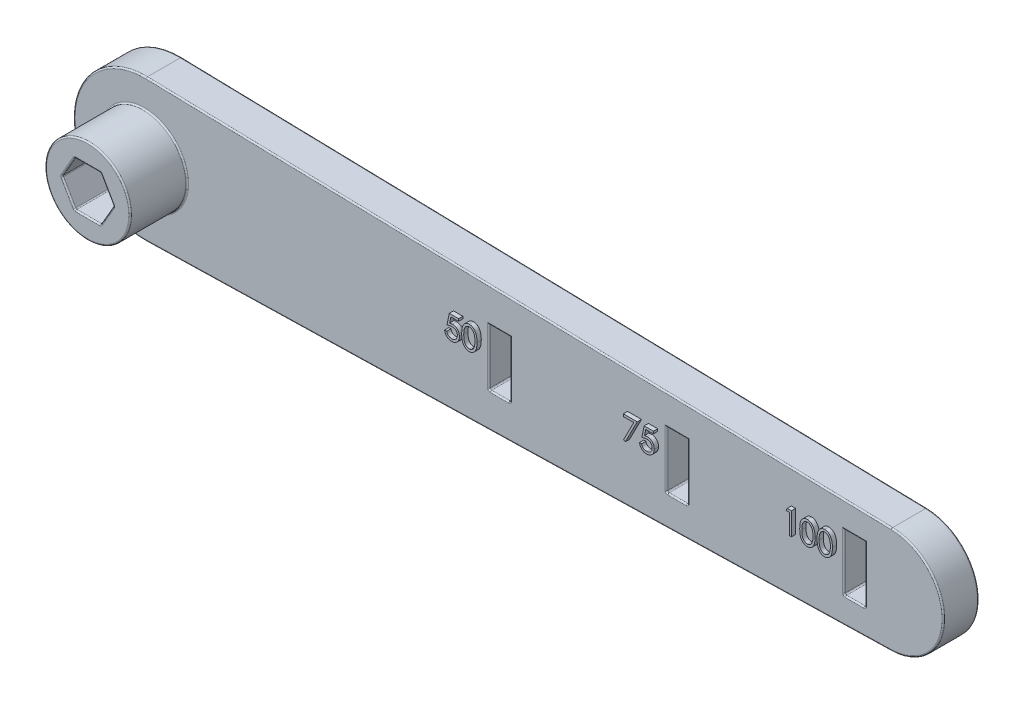
from build123d import *

# Parameters (mm, degrees)
BOSS_EXTRUDE1_DEPTH = 5
CUT_EXTRUDE2_REACH  = 115.054
CUT_EXTRUDE3_REACH  = 115.054
SKETCH4_W           = 3
SKETCH4_H           = 8
SKETCH6_R           = 6
BOSS_EXTRUDE3_DEPTH = 8
FILLET1_R           = 0.2
BOSS_EXTRUDE2_DEPTH = 0.6


with BuildPart() as part:
    # Sketch3 → Boss-Extrude1 (new body)
    with BuildSketch(Plane.XY):
        with BuildLine():
            Line((0.238095238, 9.997165131), (105.178571429, 7.497873848))
            ThreePointArc((105.178571429, 7.497873848), (112.5, 0), (105.178571429, -7.497873848))
            Line((105.178571429, -7.497873848), (0.238095238, -9.997165131))
            ThreePointArc((0.238095238, -9.997165131), (-10, 0), (0.238095238, 9.997165131))
        make_face()
    extrude(amount=BOSS_EXTRUDE1_DEPTH)

    # Sketch2 → Cut-Extrude2 (cut, up to next)
    with BuildSketch(Plane.XY, mode=Mode.PRIVATE) as cut_extrude2_sk1:
        Polygon((3.637306696, 0), (1.818653348, 3.15), (-1.818653348, 3.15), (-3.637306696, 0), (-1.818653348, -3.15), (1.818653348, -3.15), align=None)
    cut_extrude2_tool1 = extrude(cut_extrude2_sk1.sketch, amount=CUT_EXTRUDE2_REACH, mode=Mode.PRIVATE) & part.part
    add(cut_extrude2_tool1.solids().sort_by_distance((0, 0, 0))[0], mode=Mode.SUBTRACT)

    # Sketch4 → Cut-Extrude3 (cut, up to next)
    with BuildSketch(Plane.XY.offset(5), mode=Mode.PRIVATE) as cut_extrude3_sk1:
        with Locations((100, 0)):
            Rectangle(SKETCH4_W, SKETCH4_H)
    cut_extrude3_tool1 = extrude(cut_extrude3_sk1.sketch, amount=-CUT_EXTRUDE3_REACH, mode=Mode.PRIVATE) & part.part
    # Sketch4 → Cut-Extrude3 (cut, up to next)
    with BuildSketch(Plane.XY.offset(5), mode=Mode.PRIVATE) as cut_extrude3_sk2:
        with Locations((75, 0)):
            Rectangle(SKETCH4_W, SKETCH4_H)
    cut_extrude3_tool2 = extrude(cut_extrude3_sk2.sketch, amount=-CUT_EXTRUDE3_REACH, mode=Mode.PRIVATE) & part.part
    # Sketch4 → Cut-Extrude3 (cut, up to next)
    with BuildSketch(Plane.XY.offset(5), mode=Mode.PRIVATE) as cut_extrude3_sk3:
        with Locations((50, 0)):
            Rectangle(SKETCH4_W, SKETCH4_H)
    cut_extrude3_tool3 = extrude(cut_extrude3_sk3.sketch, amount=-CUT_EXTRUDE3_REACH, mode=Mode.PRIVATE) & part.part
    add(cut_extrude3_tool1.solids().sort_by_distance((100, 0, 5))[0], mode=Mode.SUBTRACT)
    add(cut_extrude3_tool2.solids().sort_by_distance((75, 0, 5))[0], mode=Mode.SUBTRACT)
    add(cut_extrude3_tool3.solids().sort_by_distance((50, 0, 5))[0], mode=Mode.SUBTRACT)

    # Sketch6 → Boss-Extrude3 (add)
    with BuildSketch(Plane.XY.offset(5)):
        Circle(SKETCH6_R)
        Polygon((3.637306696, 0), (1.818653348, 3.15), (-1.818653348, 3.15), (-3.637306696, 0), (-1.818653348, -3.15), (1.818653348, -3.15), align=None, mode=Mode.SUBTRACT)
    extrude(amount=BOSS_EXTRUDE3_DEPTH)

    # Fillet1
    fillet1_edges = [part.edges().sort_by_distance(p)[0] for p in [
        (112.5, 0, 5),
        (52.708333333, 8.74751949, 5),
        (1.818653348, -3.15, 6.5),
        (2.727980022, -1.575, 0),
        (3.637306696, 0, 6.5),
        (2.727980022, 1.575, 0),
        (1.818653348, 3.15, 6.5),
        (0, 3.15, 0),
        (-1.818653348, 3.15, 6.5),
        (-2.727980022, 1.575, 0),
        (-3.637306696, 0, 6.5),
        (-2.727980022, -1.575, 0),
        (-1.818653348, -3.15, 6.5),
        (0, -3.15, 0),
        (98.5, -4, 2.5),
        (101.5, -4, 2.5),
        (98.5, 0, 5),
        (100, -4, 5),
        (101.5, 0, 5),
        (100, 4, 5),
        (100, -4, 0),
        (98.5, 0, 0),
        (100, 4, 0),
        (101.5, 0, 0),
        (-10, 0, 5),
        (52.708333333, 8.74751949, 0),
        (73.5, -4, 2.5),
        (76.5, -4, 2.5),
        (73.5, 0, 5),
        (75, -4, 5),
        (76.5, 0, 5),
        (75, 4, 5),
        (75, -4, 0),
        (73.5, 0, 0),
        (75, 4, 0),
        (76.5, 0, 0),
        (112.5, 0, 0),
        (48.5, -4, 2.5),
        (51.5, -4, 2.5),
        (48.5, 0, 5),
        (50, -4, 5),
        (52.708333333, -8.74751949, 0),
        (51.5, 0, 5),
        (50, 4, 5),
        (50, -4, 0),
        (48.5, 0, 0),
        (50, 4, 0),
        (51.5, 0, 0),
        (-10, 0, 0),
        (-6, 0, 13),
        (-6, 0, 5),
        (2.727980022, -1.575, 13),
        (2.727980022, 1.575, 13),
        (0, 3.15, 13),
        (-2.727980022, 1.575, 13),
        (-2.727980022, -1.575, 13),
        (0, -3.15, 13),
        (52.708333333, -8.74751949, 5),
    ]]
    fillet(fillet1_edges, radius=FILLET1_R)

    # Sketch5 → Boss-Extrude2 (add)
    # profile 1 of 7: a face of its own
    with BuildSketch(Plane.XY.offset(5)):
        with BuildLine():
            Line((44.816666667, 3.175), (44.816666667, 2.849358974))
            Line((44.816666667, 2.849358974), (43.736708734, 2.849358974))
            Line((43.736708734, 2.849358974), (43.565619992, 2.014267829))
            add(Edge.make_bspline(
                [(43.565619992, 2.014267829), (43.599234964, 2.023548147), (43.664358655, 2.041527295), (43.760479386, 2.061489672), (43.851730885, 2.073523325), (43.910944971, 2.075166443), (43.939598357, 2.075961538)],
                knots=[0, 0, 0, 0, 1.100273476, 2.13160584, 3.095893838, 4, 4, 4, 4], degree=3))
            add(Edge.make_bspline(
                [(43.939598357, 2.075961538), (43.975052893, 2.075194154), (44.044765367, 2.073685284), (44.146763555, 2.059196535), (44.244129822, 2.036391041), (44.336660544, 2.004531711), (44.424526901, 1.963792167), (44.506920474, 1.912901507), (44.58507801, 1.853453414), (44.657597363, 1.785104724), (44.723387271, 1.709882972), (44.781232133, 1.629004046), (44.83036534, 1.543253952), (44.869881167, 1.4518134), (44.901435528, 1.355693311), (44.922437695, 1.253882325), (44.936422852, 1.147340102), (44.937985302, 1.074492385), (44.938782051, 1.037344752)],
                knots=[0, 0, 0, 0, 1.052922333, 2.070308379, 3.05430497, 4.020497103, 4.973039431, 5.925935799, 6.892292201, 7.88610001, 8.88166317, 9.857072816, 10.836096531, 11.812156883, 12.81219415, 13.836441305, 14.89672472, 16, 16, 16, 16], degree=3))
            add(Edge.make_bspline(
                [(44.938782051, 1.037344752), (44.938178733, 1.011471023), (44.93698025, 0.960073227), (44.930885531, 0.883742417), (44.919150989, 0.809027561), (44.903395982, 0.735918748), (44.882946788, 0.664554389), (44.858191718, 0.594730218), (44.82789675, 0.526880824), (44.79466686, 0.460364216), (44.757250412, 0.396684142), (44.715722766, 0.337131132), (44.671848356, 0.28081182), (44.624639385, 0.228330219), (44.573657054, 0.180031196), (44.519518798, 0.135628112), (44.462656617, 0.094370048), (44.40219079, 0.057931757), (44.339468681, 0.024401075), (44.273584512, -0.003106705), (44.20603802, -0.027699827), (44.135857025, -0.047302756), (44.063200495, -0.062663002), (43.987948663, -0.073095689), (43.910496198, -0.080694315), (43.857995294, -0.081169982), (43.831475361, -0.081410256)],
                knots=[0, 0, 0, 0, 1.056347294, 2.098418968, 3.122841568, 4.141288669, 5.149314143, 6.15115421, 7.162517403, 8.180376062, 9.185164535, 10.17417709, 11.141909838, 12.097768115, 13.052685741, 14.0056014, 14.954263652, 15.917497458, 16.885230207, 17.854509472, 18.828990115, 19.81800267, 20.826176721, 21.857883937, 22.917946725, 24, 24, 24, 24], degree=3))
            add(Edge.make_bspline(
                [(43.831475361, -0.081410256), (43.799839497, -0.080783568), (43.737599672, -0.079550632), (43.646413157, -0.066652434), (43.558679194, -0.048179453), (43.47510403, -0.02038798), (43.39493867, 0.014434781), (43.319262347, 0.058445879), (43.246141393, 0.10831978), (43.178548331, 0.167175529), (43.115813857, 0.231506183), (43.05965581, 0.301317758), (43.009641779, 0.375458038), (42.96657268, 0.454287077), (42.929835189, 0.537597745), (42.90097445, 0.625702181), (42.877680514, 0.718140042), (42.867825839, 0.781779298), (42.862820513, 0.814102564)],
                knots=[0, 0, 0, 0, 1.0467383, 2.05933395, 3.04377827, 4.011590433, 4.970194871, 5.932262533, 6.905835911, 7.896367577, 8.894135286, 9.877477877, 10.858688626, 11.851381753, 12.8477658, 13.868841284, 14.917554742, 16, 16, 16, 16], degree=3))
            Line((42.862820513, 0.814102564), (43.14775641, 0.814102564))
            add(Edge.make_bspline(
                [(43.14775641, 0.814102564), (43.154767316, 0.783825354), (43.168242666, 0.725630874), (43.197820738, 0.643868872), (43.233984782, 0.571007861), (43.276987298, 0.506084025), (43.328286254, 0.449470149), (43.386823665, 0.399017529), (43.452453385, 0.353501518), (43.525381529, 0.315562294), (43.602319108, 0.283205639), (43.682843649, 0.261659459), (43.764762592, 0.246509363), (43.820169399, 0.244992837), (43.848011819, 0.244230769)],
                knots=[0, 0, 0, 0, 1.136247022, 2.183929868, 3.172523383, 4.106158343, 5.02341133, 5.958108904, 6.928429099, 7.938127109, 8.96079061, 9.975095812, 10.982467395, 12, 12, 12, 12], degree=3))
            add(Edge.make_bspline(
                [(43.848011819, 0.244230769), (43.875188408, 0.244975332), (43.928699334, 0.246441382), (44.007449663, 0.257725343), (44.083479913, 0.275103997), (44.156039872, 0.301111651), (44.226399269, 0.332720789), (44.292778332, 0.37328375), (44.357097371, 0.419965339), (44.417357178, 0.473447424), (44.472547249, 0.532384219), (44.521311731, 0.59541014), (44.561930788, 0.662644708), (44.596161015, 0.732923925), (44.622153651, 0.807018045), (44.640696541, 0.884579825), (44.65158503, 0.965800843), (44.653082886, 1.021199431), (44.653846154, 1.049429087)],
                knots=[0, 0, 0, 0, 1.027316725, 2.022795036, 3.002884548, 3.971462791, 4.93288096, 5.914575861, 6.907176829, 7.935150275, 8.956128384, 9.956726525, 10.942570165, 11.921478529, 12.907843606, 13.90538589, 14.932640048, 16, 16, 16, 16], degree=3))
            add(Edge.make_bspline(
                [(44.653846154, 1.049429087), (44.653248819, 1.074897804), (44.652079621, 1.124749195), (44.642526889, 1.197682761), (44.625910778, 1.266691878), (44.602847687, 1.33210979), (44.573565563, 1.393998198), (44.537782122, 1.452420974), (44.494825825, 1.506608094), (44.445756755, 1.556584911), (44.392001246, 1.602708476), (44.332634423, 1.642027754), (44.268898632, 1.675105737), (44.201561781, 1.703651707), (44.129022195, 1.724153812), (44.052716392, 1.739546108), (43.971820379, 1.748450044), (43.916511254, 1.749685471), (43.888080929, 1.750320513)],
                knots=[0, 0, 0, 0, 1.045622112, 2.046656509, 3.013763289, 3.955457236, 4.890082067, 5.820317437, 6.762574623, 7.722996705, 8.69280354, 9.665887285, 10.63943826, 11.638615906, 12.663482002, 13.728887084, 14.832589034, 16, 16, 16, 16], degree=3))
            add(Edge.make_bspline(
                [(43.888080929, 1.750320513), (43.863471115, 1.749793834), (43.812658093, 1.748706375), (43.734713815, 1.740699481), (43.652806323, 1.727782407), (43.567249602, 1.710014883), (43.477786713, 1.686763834), (43.384606449, 1.658901395), (43.287512893, 1.625589296), (43.222091814, 1.600432216), (43.188461538, 1.5875)],
                knots=[0, 0, 0, 0, 0.817624296, 1.688186739, 2.600797293, 3.572016777, 4.590301741, 5.671205678, 6.80286297, 8, 8, 8, 8], degree=3))
            Line((43.188461538, 1.5875), (43.514102564, 3.175))
            Line((43.514102564, 3.175), (44.816666667, 3.175))
        make_face()
    # profile 2 of 7: a face of its own
    with BuildSketch(Plane.XY.offset(5)):
        with BuildLine():
            add(Edge.make_bspline(
                [(45.264423077, 1.586227965), (45.264720636, 1.637116309), (45.26529865, 1.735967652), (45.27172886, 1.880008006), (45.282410778, 2.015136268), (45.29704968, 2.141358907), (45.314864134, 2.258708507), (45.338645325, 2.366871466), (45.365689796, 2.466348394), (45.3970338, 2.557463681), (45.432401295, 2.641444883), (45.470895231, 2.719844887), (45.514043295, 2.792545069), (45.559379494, 2.860705779), (45.608739016, 2.923211273), (45.660717205, 2.98094426), (45.717342764, 3.032570441), (45.776690779, 3.079602444), (45.839298571, 3.120831607), (45.903381561, 3.15714702), (45.969380836, 3.188171185), (46.037476588, 3.212564652), (46.107056765, 3.232713063), (46.178364604, 3.246491609), (46.251517842, 3.25516109), (46.300894929, 3.255989917), (46.325936498, 3.256410256)],
                knots=[0, 0, 0, 0, 1.646270934, 3.197905019, 4.663502075, 6.030701355, 7.308322542, 8.50163776, 9.611534131, 10.641858119, 11.616356847, 12.558055219, 13.465016945, 14.349605745, 15.204443733, 16.039544428, 16.859896111, 17.680448484, 18.487036065, 19.28249412, 20.06191084, 20.843045899, 21.620316918, 22.403196591, 23.190181807, 24, 24, 24, 24], degree=3))
            add(Edge.make_bspline(
                [(46.325936498, 3.256410256), (46.351187254, 3.255967738), (46.401403062, 3.255087709), (46.475643974, 3.246629561), (46.548169756, 3.232595043), (46.618671211, 3.212709587), (46.687727449, 3.188039223), (46.754798333, 3.157117338), (46.820300471, 3.121122937), (46.883192946, 3.07882842), (46.944166204, 3.031673069), (47.001722571, 2.978366934), (47.055867284, 2.91944826), (47.107279883, 2.855547427), (47.154501746, 2.785438814), (47.199471931, 2.7103418), (47.239723706, 2.628943087), (47.278490162, 2.542600805), (47.311951928, 2.448925915), (47.342129165, 2.348446454), (47.366512229, 2.239975584), (47.386822498, 2.124082419), (47.402556796, 2.000341345), (47.414016407, 1.869017616), (47.420069849, 1.730024833), (47.421209856, 1.634994498), (47.421794872, 1.586227965)],
                knots=[0, 0, 0, 0, 0.810914788, 1.612654377, 2.396697861, 3.181598691, 3.963628158, 4.749916497, 5.551656086, 6.361998678, 7.18212741, 8.025565596, 8.878627764, 9.750805457, 10.657531673, 11.591944965, 12.560506719, 13.57287815, 14.630710178, 15.753379473, 16.941251878, 18.199788006, 19.531962791, 20.947069417, 22.433333509, 24, 24, 24, 24], degree=3))
            add(Edge.make_bspline(
                [(47.421794872, 1.586227965), (47.421203792, 1.537674134), (47.420052096, 1.443068975), (47.414084269, 1.30470159), (47.402328939, 1.174074794), (47.387624164, 1.050875303), (47.367257933, 0.935615891), (47.342216104, 0.827897713), (47.314411883, 0.727255591), (47.280090319, 0.634514012), (47.242524889, 0.548379235), (47.20165339, 0.467945464), (47.157865762, 0.392501756), (47.110160258, 0.322651986), (47.059311804, 0.257901347), (47.004232096, 0.199392789), (46.946473779, 0.145716537), (46.885321088, 0.097953989), (46.821447752, 0.056148487), (46.756170589, 0.018761637), (46.688331377, -0.011385165), (46.619467484, -0.037270523), (46.548593895, -0.057046647), (46.475798955, -0.070720788), (46.401452941, -0.080310965), (46.351195807, -0.081042557), (46.325936498, -0.081410256)],
                knots=[0, 0, 0, 0, 1.561518951, 3.042555995, 4.452378317, 5.7783523, 7.031515105, 8.214008947, 9.334062868, 10.386615937, 11.391082383, 12.354592575, 13.286541444, 14.194233754, 15.072674879, 15.931287219, 16.775624067, 17.606195743, 18.42308326, 19.229000347, 20.022332153, 20.807536673, 21.593273796, 22.3848459, 23.188221202, 24, 24, 24, 24], degree=3))
            add(Edge.make_bspline(
                [(46.325936498, -0.081410256), (46.300895624, -0.080987205), (46.251519906, -0.080153031), (46.178356634, -0.071522718), (46.107343275, -0.057647511), (46.038129405, -0.038219592), (45.970359924, -0.01443899), (45.904958292, 0.01654328), (45.841197322, 0.052224899), (45.779247125, 0.092860746), (45.720271807, 0.139416844), (45.663939501, 0.190910163), (45.611665377, 0.248625686), (45.56301159, 0.311652088), (45.51677081, 0.379409529), (45.47423545, 0.452823125), (45.434891889, 0.531601779), (45.39892958, 0.616254455), (45.367044721, 0.708016425), (45.338880014, 0.807937466), (45.316642171, 0.916899507), (45.297607633, 1.034027404), (45.2822548, 1.15982447), (45.271773376, 1.294358997), (45.265295184, 1.437547151), (45.264719084, 1.535763303), (45.264423077, 1.586227965)],
                knots=[0, 0, 0, 0, 0.810891512, 1.598919785, 2.382837074, 3.152667961, 3.926044502, 4.706494248, 5.493654104, 6.291793342, 7.103789334, 7.925228297, 8.761435821, 9.622817696, 10.50288917, 11.416980706, 12.369136599, 13.353924996, 14.394355917, 15.514179734, 16.714354668, 17.994756427, 19.357759367, 20.818452758, 22.365282078, 24, 24, 24, 24], degree=3))
        make_face()
        with BuildLine():
            add(Edge.make_bspline(
                [(45.549358974, 1.5875), (45.54946733, 1.545092252), (45.549677627, 1.46278714), (45.555171466, 1.343186467), (45.562655605, 1.231634812), (45.572308782, 1.127990532), (45.586644313, 1.03260445), (45.6027069, 0.944820523), (45.622254095, 0.865103315), (45.645381719, 0.792905801), (45.671724328, 0.727002717), (45.700486076, 0.665678758), (45.731384017, 0.608209501), (45.765963532, 0.555111156), (45.803623625, 0.506210565), (45.843513653, 0.46064221), (45.887122355, 0.420004948), (45.94745075, 0.371267015), (46.027094694, 0.32090323), (46.12744325, 0.27704642), (46.230556774, 0.249485191), (46.300543979, 0.245980213), (46.335476763, 0.244230769)],
                knots=[0, 0, 0, 0, 1.459021318, 2.831673884, 4.118529203, 5.306027144, 6.411944654, 7.436330062, 8.375795394, 9.233974572, 10.042671642, 10.816086306, 11.563610507, 12.285937304, 12.993564865, 13.685989202, 14.367179055, 15.041617293, 16.353048772, 17.594441528, 18.799311195, 20, 20, 20, 20], degree=3))
            add(Edge.make_bspline(
                [(46.335476763, 0.244230769), (46.370635508, 0.245680185), (46.440880408, 0.248576023), (46.543508922, 0.276514878), (46.643140667, 0.318669388), (46.721220213, 0.368514626), (46.780622235, 0.415983896), (46.823182647, 0.456455755), (46.862246077, 0.501772864), (46.899295673, 0.550667225), (46.933276406, 0.604072978), (46.964176538, 0.661733315), (46.992373575, 0.723808354), (47.00843821, 0.767142332), (47.016651643, 0.789297877)],
                knots=[0, 0, 0, 0, 1.353760809, 2.704726607, 4.075137775, 5.516104923, 6.260822281, 7.007110065, 7.778089737, 8.566572457, 9.372053459, 10.217411131, 11.088608312, 12, 12, 12, 12], degree=3))
            add(Edge.make_bspline(
                [(47.016651643, 0.789297877), (47.026223603, 0.817627712), (47.045658789, 0.875149426), (47.070706613, 0.964379311), (47.090432796, 1.057998961), (47.108179564, 1.155448888), (47.120292693, 1.25744776), (47.130042495, 1.36367998), (47.135785332, 1.474225644), (47.136497214, 1.549332529), (47.136858974, 1.5875)],
                knots=[0, 0, 0, 0, 0.884706709, 1.796334032, 2.740027952, 3.714592787, 4.726048262, 5.777819803, 6.87074269, 8, 8, 8, 8], degree=3))
            add(Edge.make_bspline(
                [(47.136858974, 1.5875), (47.136359874, 1.625661298), (47.135383527, 1.700312955), (47.131651553, 1.809640161), (47.122014453, 1.913478773), (47.111310967, 2.01227613), (47.095529202, 2.105485333), (47.078513191, 2.193886682), (47.055652092, 2.276384997), (47.03123201, 2.354271903), (47.00328258, 2.426662497), (46.972516164, 2.493894289), (46.939657854, 2.556291861), (46.903968822, 2.613684015), (46.865872738, 2.666327822), (46.824364104, 2.713167775), (46.781089423, 2.755655596), (46.72047669, 2.804153784), (46.641125013, 2.853603679), (46.542386461, 2.89911119), (46.439633805, 2.925244427), (46.370170743, 2.928928957), (46.335476763, 2.930769231)],
                knots=[0, 0, 0, 0, 1.31362396, 2.569729283, 3.763502607, 4.902122613, 5.988968491, 7.01645872, 7.998833611, 8.933434873, 9.825090667, 10.667526885, 11.477055099, 12.250526234, 12.991942729, 13.710640831, 14.402115721, 15.076753259, 16.378508321, 17.609869233, 18.806226677, 20, 20, 20, 20], degree=3))
            add(Edge.make_bspline(
                [(46.335476763, 2.930769231), (46.300360726, 2.928926418), (46.230064678, 2.925237437), (46.126244034, 2.899208557), (46.026726515, 2.853839652), (45.947584674, 2.80399), (45.886929667, 2.756511674), (45.844218938, 2.715339677), (45.804172053, 2.670303432), (45.76728064, 2.620953123), (45.732728219, 2.567916683), (45.700995443, 2.510776875), (45.672404722, 2.449244137), (45.646020893, 2.383370657), (45.622822721, 2.311179371), (45.603687483, 2.231560356), (45.586009942, 2.144055639), (45.573495662, 2.048152943), (45.562370684, 1.944482704), (45.555221175, 1.832652565), (45.549659249, 1.712851306), (45.549461071, 1.630120641), (45.549358974, 1.5875)],
                knots=[0, 0, 0, 0, 1.207732386, 2.417664972, 3.655092373, 4.956220595, 5.625982001, 6.301752483, 6.994047911, 7.697131622, 8.419323945, 9.170223765, 9.943494443, 10.752040957, 11.610060368, 12.549350801, 13.567764191, 14.679664412, 15.874934091, 17.154273443, 18.533957287, 20, 20, 20, 20], degree=3))
        make_face(mode=Mode.SUBTRACT)
    # profile 3 of 7: a face of its own
    with BuildSketch(Plane.XY.offset(5)):
        Polygon((68.025641026, 3.175), (69.979487179, 3.175), (68.310576923, -0.081410256), (68.064438101, 0.054061498), (69.497385817, 2.849358974), (68.025641026, 2.849358974), align=None)
    # profile 4 of 7: a face of its own
    with BuildSketch(Plane.XY.offset(5)):
        with BuildLine():
            Line((72.258974359, 3.175), (72.258974359, 2.849358974))
            Line((72.258974359, 2.849358974), (71.179016426, 2.849358974))
            Line((71.179016426, 2.849358974), (71.007927684, 2.014267829))
            add(Edge.make_bspline(
                [(71.007927684, 2.014267829), (71.041542656, 2.023548147), (71.106666347, 2.041527295), (71.202787078, 2.061489672), (71.294038577, 2.073523325), (71.353252663, 2.075166443), (71.38190605, 2.075961538)],
                knots=[0, 0, 0, 0, 1.100273476, 2.13160584, 3.095893838, 4, 4, 4, 4], degree=3))
            add(Edge.make_bspline(
                [(71.38190605, 2.075961538), (71.417360585, 2.075194154), (71.48707306, 2.073685284), (71.589071247, 2.059196535), (71.686437515, 2.036391041), (71.778968236, 2.004531711), (71.866834593, 1.963792167), (71.949228167, 1.912901507), (72.027385702, 1.853453414), (72.099905055, 1.785104724), (72.165694963, 1.709882972), (72.223539825, 1.629004046), (72.272673032, 1.543253952), (72.31218886, 1.4518134), (72.34374322, 1.355693311), (72.364745387, 1.253882325), (72.378730544, 1.147340102), (72.380292995, 1.074492385), (72.381089744, 1.037344752)],
                knots=[0, 0, 0, 0, 1.052922333, 2.070308379, 3.05430497, 4.020497103, 4.973039431, 5.925935799, 6.892292201, 7.88610001, 8.88166317, 9.857072816, 10.836096531, 11.812156883, 12.81219415, 13.836441305, 14.89672472, 16, 16, 16, 16], degree=3))
            add(Edge.make_bspline(
                [(72.381089744, 1.037344752), (72.380486425, 1.011471023), (72.379287942, 0.960073227), (72.373193223, 0.883742417), (72.361458681, 0.809027561), (72.345703674, 0.735918748), (72.325254481, 0.664554389), (72.30049941, 0.594730218), (72.270204442, 0.526880824), (72.236974552, 0.460364216), (72.199558104, 0.396684142), (72.158030458, 0.337131132), (72.114156048, 0.28081182), (72.066947077, 0.228330219), (72.015964746, 0.180031196), (71.96182649, 0.135628112), (71.904964309, 0.094370048), (71.844498482, 0.057931757), (71.781776373, 0.024401075), (71.715892204, -0.003106705), (71.648345712, -0.027699827), (71.578164718, -0.047302756), (71.505508188, -0.062663002), (71.430256356, -0.073095689), (71.352803891, -0.080694315), (71.300302986, -0.081169982), (71.273783053, -0.081410256)],
                knots=[0, 0, 0, 0, 1.056347294, 2.098418968, 3.122841568, 4.141288669, 5.149314143, 6.15115421, 7.162517403, 8.180376062, 9.185164535, 10.17417709, 11.141909838, 12.097768115, 13.052685741, 14.0056014, 14.954263652, 15.917497458, 16.885230207, 17.854509472, 18.828990115, 19.81800267, 20.826176721, 21.857883937, 22.917946725, 24, 24, 24, 24], degree=3))
            add(Edge.make_bspline(
                [(71.273783053, -0.081410256), (71.242147189, -0.080783568), (71.179907364, -0.079550632), (71.08872085, -0.066652434), (71.000986886, -0.048179453), (70.917411723, -0.02038798), (70.837246362, 0.014434781), (70.761570039, 0.058445879), (70.688449085, 0.10831978), (70.620856024, 0.167175529), (70.558121549, 0.231506183), (70.501963502, 0.301317758), (70.451949471, 0.375458038), (70.408880372, 0.454287077), (70.372142882, 0.537597745), (70.343282142, 0.625702181), (70.319988206, 0.718140042), (70.310133532, 0.781779298), (70.305128205, 0.814102564)],
                knots=[0, 0, 0, 0, 1.0467383, 2.05933395, 3.04377827, 4.011590433, 4.970194871, 5.932262533, 6.905835911, 7.896367577, 8.894135286, 9.877477877, 10.858688626, 11.851381753, 12.8477658, 13.868841284, 14.917554742, 16, 16, 16, 16], degree=3))
            Line((70.305128205, 0.814102564), (70.590064103, 0.814102564))
            add(Edge.make_bspline(
                [(70.590064103, 0.814102564), (70.597075008, 0.783825354), (70.610550358, 0.725630874), (70.64012843, 0.643868872), (70.676292474, 0.571007861), (70.71929499, 0.506084025), (70.770593947, 0.449470149), (70.829131357, 0.399017529), (70.894761078, 0.353501518), (70.967689221, 0.315562294), (71.044626801, 0.283205639), (71.125151341, 0.261659459), (71.207070284, 0.246509363), (71.262477091, 0.244992837), (71.290319511, 0.244230769)],
                knots=[0, 0, 0, 0, 1.136247022, 2.183929868, 3.172523383, 4.106158343, 5.02341133, 5.958108904, 6.928429099, 7.938127109, 8.96079061, 9.975095812, 10.982467395, 12, 12, 12, 12], degree=3))
            add(Edge.make_bspline(
                [(71.290319511, 0.244230769), (71.3174961, 0.244975332), (71.371007026, 0.246441382), (71.449757355, 0.257725343), (71.525787605, 0.275103997), (71.598347565, 0.301111651), (71.668706961, 0.332720789), (71.735086025, 0.37328375), (71.799405063, 0.419965339), (71.85966487, 0.473447424), (71.914854942, 0.532384219), (71.963619423, 0.59541014), (72.00423848, 0.662644708), (72.038468708, 0.732923925), (72.064461343, 0.807018045), (72.083004233, 0.884579825), (72.093892722, 0.965800843), (72.095390578, 1.021199431), (72.096153846, 1.049429087)],
                knots=[0, 0, 0, 0, 1.027316725, 2.022795036, 3.002884548, 3.971462791, 4.93288096, 5.914575861, 6.907176829, 7.935150275, 8.956128384, 9.956726525, 10.942570165, 11.921478529, 12.907843606, 13.90538589, 14.932640048, 16, 16, 16, 16], degree=3))
            add(Edge.make_bspline(
                [(72.096153846, 1.049429087), (72.095556511, 1.074897804), (72.094387313, 1.124749195), (72.084834581, 1.197682761), (72.068218471, 1.266691878), (72.04515538, 1.33210979), (72.015873255, 1.393998198), (71.980089814, 1.452420974), (71.937133518, 1.506608094), (71.888064447, 1.556584911), (71.834308939, 1.602708476), (71.774942115, 1.642027754), (71.711206324, 1.675105737), (71.643869473, 1.703651707), (71.571329887, 1.724153812), (71.495024085, 1.739546108), (71.414128071, 1.748450044), (71.358818947, 1.749685471), (71.330388622, 1.750320513)],
                knots=[0, 0, 0, 0, 1.045622112, 2.046656509, 3.013763289, 3.955457236, 4.890082067, 5.820317437, 6.762574623, 7.722996705, 8.69280354, 9.665887285, 10.63943826, 11.638615906, 12.663482002, 13.728887084, 14.832589034, 16, 16, 16, 16], degree=3))
            add(Edge.make_bspline(
                [(71.330388622, 1.750320513), (71.305778808, 1.749793834), (71.254965785, 1.748706375), (71.177021507, 1.740699481), (71.095114015, 1.727782407), (71.009557294, 1.710014883), (70.920094405, 1.686763834), (70.826914141, 1.658901395), (70.729820585, 1.625589296), (70.664399507, 1.600432216), (70.630769231, 1.5875)],
                knots=[0, 0, 0, 0, 0.817624296, 1.688186739, 2.600797293, 3.572016777, 4.590301741, 5.671205678, 6.80286297, 8, 8, 8, 8], degree=3))
            Line((70.630769231, 1.5875), (70.956410256, 3.175))
            Line((70.956410256, 3.175), (72.258974359, 3.175))
        make_face()
    # profile 5 of 7: a face of its own
    with BuildSketch(Plane.XY.offset(5)):
        Polygon((91.096930088, 3.175), (91.683974359, 3.175), (91.683974359, 0), (91.399038462, 0), (91.399038462, 2.849358974), (90.910576923, 2.849358974), align=None)
    # profile 6 of 7: a face of its own
    with BuildSketch(Plane.XY.offset(5)):
        with BuildLine():
            add(Edge.make_bspline(
                [(92.864423077, 1.586227965), (92.864720636, 1.637116309), (92.86529865, 1.735967652), (92.87172886, 1.880008006), (92.882410778, 2.015136268), (92.89704968, 2.141358907), (92.914864134, 2.258708507), (92.938645325, 2.366871466), (92.965689796, 2.466348394), (92.9970338, 2.557463681), (93.032401295, 2.641444883), (93.070895231, 2.719844887), (93.114043295, 2.792545069), (93.159379494, 2.860705779), (93.208739016, 2.923211273), (93.260717205, 2.98094426), (93.317342764, 3.032570441), (93.376690779, 3.079602444), (93.439298571, 3.120831607), (93.503381561, 3.15714702), (93.569380836, 3.188171185), (93.637476588, 3.212564652), (93.707056765, 3.232713063), (93.778364604, 3.246491609), (93.851517842, 3.25516109), (93.900894929, 3.255989917), (93.925936498, 3.256410256)],
                knots=[0, 0, 0, 0, 1.646270934, 3.197905019, 4.663502075, 6.030701355, 7.308322542, 8.50163776, 9.611534131, 10.641858119, 11.616356847, 12.558055219, 13.465016945, 14.349605745, 15.204443733, 16.039544428, 16.859896111, 17.680448484, 18.487036065, 19.28249412, 20.06191084, 20.843045899, 21.620316918, 22.403196591, 23.190181807, 24, 24, 24, 24], degree=3))
            add(Edge.make_bspline(
                [(93.925936498, 3.256410256), (93.951187254, 3.255967738), (94.001403062, 3.255087709), (94.075643974, 3.246629561), (94.148169756, 3.232595043), (94.218671211, 3.212709587), (94.287727449, 3.188039223), (94.354798333, 3.157117338), (94.420300471, 3.121122937), (94.483192946, 3.07882842), (94.544166204, 3.031673069), (94.601722571, 2.978366934), (94.655867284, 2.91944826), (94.707279883, 2.855547427), (94.754501746, 2.785438814), (94.799471931, 2.7103418), (94.839723706, 2.628943087), (94.878490162, 2.542600805), (94.911951928, 2.448925915), (94.942129165, 2.348446454), (94.966512229, 2.239975584), (94.986822498, 2.124082419), (95.002556796, 2.000341345), (95.014016407, 1.869017616), (95.020069849, 1.730024833), (95.021209856, 1.634994498), (95.021794872, 1.586227965)],
                knots=[0, 0, 0, 0, 0.810914788, 1.612654377, 2.396697861, 3.181598691, 3.963628158, 4.749916497, 5.551656086, 6.361998678, 7.18212741, 8.025565596, 8.878627764, 9.750805457, 10.657531673, 11.591944965, 12.560506719, 13.57287815, 14.630710178, 15.753379473, 16.941251878, 18.199788006, 19.531962791, 20.947069417, 22.433333509, 24, 24, 24, 24], degree=3))
            add(Edge.make_bspline(
                [(95.021794872, 1.586227965), (95.021203792, 1.537674134), (95.020052096, 1.443068975), (95.014084269, 1.30470159), (95.002328939, 1.174074794), (94.987624164, 1.050875303), (94.967257933, 0.935615891), (94.942216104, 0.827897713), (94.914411883, 0.727255591), (94.880090319, 0.634514012), (94.842524889, 0.548379235), (94.80165339, 0.467945464), (94.757865762, 0.392501756), (94.710160258, 0.322651986), (94.659311804, 0.257901347), (94.604232096, 0.199392789), (94.546473779, 0.145716537), (94.485321088, 0.097953989), (94.421447752, 0.056148487), (94.356170589, 0.018761637), (94.288331377, -0.011385165), (94.219467484, -0.037270523), (94.148593895, -0.057046647), (94.075798955, -0.070720788), (94.001452941, -0.080310965), (93.951195807, -0.081042557), (93.925936498, -0.081410256)],
                knots=[0, 0, 0, 0, 1.561518951, 3.042555995, 4.452378317, 5.7783523, 7.031515105, 8.214008947, 9.334062868, 10.386615937, 11.391082383, 12.354592575, 13.286541444, 14.194233754, 15.072674879, 15.931287219, 16.775624067, 17.606195743, 18.42308326, 19.229000347, 20.022332153, 20.807536673, 21.593273796, 22.3848459, 23.188221202, 24, 24, 24, 24], degree=3))
            add(Edge.make_bspline(
                [(93.925936498, -0.081410256), (93.900895624, -0.080987205), (93.851519906, -0.080153031), (93.778356634, -0.071522718), (93.707343275, -0.057647511), (93.638129405, -0.038219592), (93.570359924, -0.01443899), (93.504958292, 0.01654328), (93.441197322, 0.052224899), (93.379247125, 0.092860746), (93.320271807, 0.139416844), (93.263939501, 0.190910163), (93.211665377, 0.248625686), (93.16301159, 0.311652088), (93.11677081, 0.379409529), (93.07423545, 0.452823125), (93.034891889, 0.531601779), (92.99892958, 0.616254455), (92.967044721, 0.708016425), (92.938880014, 0.807937466), (92.916642171, 0.916899507), (92.897607633, 1.034027404), (92.8822548, 1.15982447), (92.871773376, 1.294358997), (92.865295184, 1.437547151), (92.864719084, 1.535763303), (92.864423077, 1.586227965)],
                knots=[0, 0, 0, 0, 0.810891512, 1.598919785, 2.382837074, 3.152667961, 3.926044502, 4.706494248, 5.493654104, 6.291793342, 7.103789334, 7.925228297, 8.761435821, 9.622817696, 10.50288917, 11.416980706, 12.369136599, 13.353924996, 14.394355917, 15.514179734, 16.714354668, 17.994756427, 19.357759367, 20.818452758, 22.365282078, 24, 24, 24, 24], degree=3))
        make_face()
        with BuildLine():
            add(Edge.make_bspline(
                [(93.149358974, 1.5875), (93.14946733, 1.545092252), (93.149677627, 1.46278714), (93.155171466, 1.343186467), (93.162655605, 1.231634812), (93.172308782, 1.127990532), (93.186644313, 1.03260445), (93.2027069, 0.944820523), (93.222254095, 0.865103315), (93.245381719, 0.792905801), (93.271724328, 0.727002717), (93.300486076, 0.665678758), (93.331384017, 0.608209501), (93.365963532, 0.555111156), (93.403623625, 0.506210565), (93.443513653, 0.46064221), (93.487122355, 0.420004948), (93.54745075, 0.371267015), (93.627094694, 0.32090323), (93.72744325, 0.27704642), (93.830556774, 0.249485191), (93.900543979, 0.245980213), (93.935476763, 0.244230769)],
                knots=[0, 0, 0, 0, 1.459021318, 2.831673884, 4.118529203, 5.306027144, 6.411944654, 7.436330062, 8.375795394, 9.233974572, 10.042671642, 10.816086306, 11.563610507, 12.285937304, 12.993564865, 13.685989202, 14.367179055, 15.041617293, 16.353048772, 17.594441528, 18.799311195, 20, 20, 20, 20], degree=3))
            add(Edge.make_bspline(
                [(93.935476763, 0.244230769), (93.970635508, 0.245680185), (94.040880408, 0.248576023), (94.143508922, 0.276514878), (94.243140667, 0.318669388), (94.321220213, 0.368514626), (94.380622235, 0.415983896), (94.423182647, 0.456455755), (94.462246077, 0.501772864), (94.499295673, 0.550667225), (94.533276406, 0.604072978), (94.564176538, 0.661733315), (94.592373575, 0.723808354), (94.60843821, 0.767142332), (94.616651643, 0.789297877)],
                knots=[0, 0, 0, 0, 1.353760809, 2.704726607, 4.075137775, 5.516104923, 6.260822281, 7.007110065, 7.778089737, 8.566572457, 9.372053459, 10.217411131, 11.088608312, 12, 12, 12, 12], degree=3))
            add(Edge.make_bspline(
                [(94.616651643, 0.789297877), (94.626223603, 0.817627712), (94.645658789, 0.875149426), (94.670706613, 0.964379311), (94.690432796, 1.057998961), (94.708179564, 1.155448888), (94.720292693, 1.25744776), (94.730042495, 1.36367998), (94.735785332, 1.474225644), (94.736497214, 1.549332529), (94.736858974, 1.5875)],
                knots=[0, 0, 0, 0, 0.884706709, 1.796334032, 2.740027952, 3.714592787, 4.726048262, 5.777819803, 6.87074269, 8, 8, 8, 8], degree=3))
            add(Edge.make_bspline(
                [(94.736858974, 1.5875), (94.736359874, 1.625661298), (94.735383527, 1.700312955), (94.731651553, 1.809640161), (94.722014453, 1.913478773), (94.711310967, 2.01227613), (94.695529202, 2.105485333), (94.678513191, 2.193886682), (94.655652092, 2.276384997), (94.63123201, 2.354271903), (94.60328258, 2.426662497), (94.572516164, 2.493894289), (94.539657854, 2.556291861), (94.503968822, 2.613684015), (94.465872738, 2.666327822), (94.424364104, 2.713167775), (94.381089423, 2.755655596), (94.32047669, 2.804153784), (94.241125013, 2.853603679), (94.142386461, 2.89911119), (94.039633805, 2.925244427), (93.970170743, 2.928928957), (93.935476763, 2.930769231)],
                knots=[0, 0, 0, 0, 1.31362396, 2.569729283, 3.763502607, 4.902122613, 5.988968491, 7.01645872, 7.998833611, 8.933434873, 9.825090667, 10.667526885, 11.477055099, 12.250526234, 12.991942729, 13.710640831, 14.402115721, 15.076753259, 16.378508321, 17.609869233, 18.806226677, 20, 20, 20, 20], degree=3))
            add(Edge.make_bspline(
                [(93.935476763, 2.930769231), (93.900360726, 2.928926418), (93.830064678, 2.925237437), (93.726244034, 2.899208557), (93.626726515, 2.853839652), (93.547584674, 2.80399), (93.486929667, 2.756511674), (93.444218938, 2.715339677), (93.404172053, 2.670303432), (93.36728064, 2.620953123), (93.332728219, 2.567916683), (93.300995443, 2.510776875), (93.272404722, 2.449244137), (93.246020893, 2.383370657), (93.222822721, 2.311179371), (93.203687483, 2.231560356), (93.186009942, 2.144055639), (93.173495662, 2.048152943), (93.162370684, 1.944482704), (93.155221175, 1.832652565), (93.149659249, 1.712851306), (93.149461071, 1.630120641), (93.149358974, 1.5875)],
                knots=[0, 0, 0, 0, 1.207732386, 2.417664972, 3.655092373, 4.956220595, 5.625982001, 6.301752483, 6.994047911, 7.697131622, 8.419323945, 9.170223765, 9.943494443, 10.752040957, 11.610060368, 12.549350801, 13.567764191, 14.679664412, 15.874934091, 17.154273443, 18.533957287, 20, 20, 20, 20], degree=3))
        make_face(mode=Mode.SUBTRACT)
    # profile 7 of 7: a face of its own
    with BuildSketch(Plane.XY.offset(5)):
        with BuildLine():
            add(Edge.make_bspline(
                [(95.306730769, 1.586227965), (95.307028329, 1.637116309), (95.307606342, 1.735967652), (95.314036552, 1.880008006), (95.32471847, 2.015136268), (95.339357372, 2.141358907), (95.357171826, 2.258708507), (95.380953017, 2.366871466), (95.407997488, 2.466348394), (95.439341493, 2.557463681), (95.474708987, 2.641444883), (95.513202924, 2.719844887), (95.556350987, 2.792545069), (95.601687187, 2.860705779), (95.651046709, 2.923211273), (95.703024897, 2.98094426), (95.759650456, 3.032570441), (95.818998471, 3.079602444), (95.881606264, 3.120831607), (95.945689254, 3.15714702), (96.011688528, 3.188171185), (96.07978428, 3.212564652), (96.149364458, 3.232713063), (96.220672297, 3.246491609), (96.293825534, 3.25516109), (96.343202621, 3.255989917), (96.368244191, 3.256410256)],
                knots=[0, 0, 0, 0, 1.646270934, 3.197905019, 4.663502075, 6.030701355, 7.308322542, 8.50163776, 9.611534131, 10.641858119, 11.616356847, 12.558055219, 13.465016945, 14.349605745, 15.204443733, 16.039544428, 16.859896111, 17.680448484, 18.487036065, 19.28249412, 20.06191084, 20.843045899, 21.620316918, 22.403196591, 23.190181807, 24, 24, 24, 24], degree=3))
            add(Edge.make_bspline(
                [(96.368244191, 3.256410256), (96.393494946, 3.255967738), (96.443710754, 3.255087709), (96.517951666, 3.246629561), (96.590477449, 3.232595043), (96.660978903, 3.212709587), (96.730035141, 3.188039223), (96.797106025, 3.157117338), (96.862608163, 3.121122937), (96.925500638, 3.07882842), (96.986473897, 3.031673069), (97.044030263, 2.978366934), (97.098174977, 2.91944826), (97.149587575, 2.855547427), (97.196809438, 2.785438814), (97.241779623, 2.7103418), (97.282031399, 2.628943087), (97.320797854, 2.542600805), (97.354259621, 2.448925915), (97.384436857, 2.348446454), (97.408819922, 2.239975584), (97.42913019, 2.124082419), (97.444864489, 2.000341345), (97.4563241, 1.869017616), (97.462377541, 1.730024833), (97.463517549, 1.634994498), (97.464102564, 1.586227965)],
                knots=[0, 0, 0, 0, 0.810914788, 1.612654377, 2.396697861, 3.181598691, 3.963628158, 4.749916497, 5.551656086, 6.361998678, 7.18212741, 8.025565596, 8.878627764, 9.750805457, 10.657531673, 11.591944965, 12.560506719, 13.57287815, 14.630710178, 15.753379473, 16.941251878, 18.199788006, 19.531962791, 20.947069417, 22.433333509, 24, 24, 24, 24], degree=3))
            add(Edge.make_bspline(
                [(97.464102564, 1.586227965), (97.463511484, 1.537674134), (97.462359788, 1.443068975), (97.456391961, 1.30470159), (97.444636631, 1.174074794), (97.429931856, 1.050875303), (97.409565626, 0.935615891), (97.384523796, 0.827897713), (97.356719575, 0.727255591), (97.322398012, 0.634514012), (97.284832582, 0.548379235), (97.243961082, 0.467945464), (97.200173454, 0.392501756), (97.15246795, 0.322651986), (97.101619496, 0.257901347), (97.046539788, 0.199392789), (96.988781472, 0.145716537), (96.92762878, 0.097953989), (96.863755444, 0.056148487), (96.798478282, 0.018761637), (96.73063907, -0.011385165), (96.661775177, -0.037270523), (96.590901587, -0.057046647), (96.518106647, -0.070720788), (96.443760633, -0.080310965), (96.393503499, -0.081042557), (96.368244191, -0.081410256)],
                knots=[0, 0, 0, 0, 1.561518951, 3.042555995, 4.452378317, 5.7783523, 7.031515105, 8.214008947, 9.334062868, 10.386615937, 11.391082383, 12.354592575, 13.286541444, 14.194233754, 15.072674879, 15.931287219, 16.775624067, 17.606195743, 18.42308326, 19.229000347, 20.022332153, 20.807536673, 21.593273796, 22.3848459, 23.188221202, 24, 24, 24, 24], degree=3))
            add(Edge.make_bspline(
                [(96.368244191, -0.081410256), (96.343203316, -0.080987205), (96.293827598, -0.080153031), (96.220664327, -0.071522718), (96.149650967, -0.057647511), (96.080437098, -0.038219592), (96.012667616, -0.01443899), (95.947265985, 0.01654328), (95.883505014, 0.052224899), (95.821554817, 0.092860746), (95.7625795, 0.139416844), (95.706247193, 0.190910163), (95.653973069, 0.248625686), (95.605319282, 0.311652088), (95.559078502, 0.379409529), (95.516543142, 0.452823125), (95.477199582, 0.531601779), (95.441237272, 0.616254455), (95.409352413, 0.708016425), (95.381187707, 0.807937466), (95.358949864, 0.916899507), (95.339915326, 1.034027404), (95.324562492, 1.15982447), (95.314081069, 1.294358997), (95.307602876, 1.437547151), (95.307026776, 1.535763303), (95.306730769, 1.586227965)],
                knots=[0, 0, 0, 0, 0.810891512, 1.598919785, 2.382837074, 3.152667961, 3.926044502, 4.706494248, 5.493654104, 6.291793342, 7.103789334, 7.925228297, 8.761435821, 9.622817696, 10.50288917, 11.416980706, 12.369136599, 13.353924996, 14.394355917, 15.514179734, 16.714354668, 17.994756427, 19.357759367, 20.818452758, 22.365282078, 24, 24, 24, 24], degree=3))
        make_face()
        with BuildLine():
            add(Edge.make_bspline(
                [(95.591666667, 1.5875), (95.591775022, 1.545092252), (95.591985319, 1.46278714), (95.597479158, 1.343186467), (95.604963297, 1.231634812), (95.614616474, 1.127990532), (95.628952006, 1.03260445), (95.645014592, 0.944820523), (95.664561787, 0.865103315), (95.687689411, 0.792905801), (95.71403202, 0.727002717), (95.742793768, 0.665678758), (95.773691709, 0.608209501), (95.808271225, 0.555111156), (95.845931318, 0.506210565), (95.885821346, 0.46064221), (95.929430047, 0.420004948), (95.989758442, 0.371267015), (96.069402387, 0.32090323), (96.169750942, 0.27704642), (96.272864466, 0.249485191), (96.342851671, 0.245980213), (96.377784455, 0.244230769)],
                knots=[0, 0, 0, 0, 1.459021318, 2.831673884, 4.118529203, 5.306027144, 6.411944654, 7.436330062, 8.375795394, 9.233974572, 10.042671642, 10.816086306, 11.563610507, 12.285937304, 12.993564865, 13.685989202, 14.367179055, 15.041617293, 16.353048772, 17.594441528, 18.799311195, 20, 20, 20, 20], degree=3))
            add(Edge.make_bspline(
                [(96.377784455, 0.244230769), (96.4129432, 0.245680185), (96.4831881, 0.248576023), (96.585816615, 0.276514878), (96.68544836, 0.318669388), (96.763527905, 0.368514626), (96.822929927, 0.415983896), (96.86549034, 0.456455755), (96.904553769, 0.501772864), (96.941603366, 0.550667225), (96.975584099, 0.604072978), (97.006484231, 0.661733315), (97.034681267, 0.723808354), (97.050745902, 0.767142332), (97.058959335, 0.789297877)],
                knots=[0, 0, 0, 0, 1.353760809, 2.704726607, 4.075137775, 5.516104923, 6.260822281, 7.007110065, 7.778089737, 8.566572457, 9.372053459, 10.217411131, 11.088608312, 12, 12, 12, 12], degree=3))
            add(Edge.make_bspline(
                [(97.058959335, 0.789297877), (97.068531296, 0.817627712), (97.087966481, 0.875149426), (97.113014305, 0.964379311), (97.132740488, 1.057998961), (97.150487256, 1.155448888), (97.162600385, 1.25744776), (97.172350187, 1.36367998), (97.178093025, 1.474225644), (97.178804906, 1.549332529), (97.179166667, 1.5875)],
                knots=[0, 0, 0, 0, 0.884706709, 1.796334032, 2.740027952, 3.714592787, 4.726048262, 5.777819803, 6.87074269, 8, 8, 8, 8], degree=3))
            add(Edge.make_bspline(
                [(97.179166667, 1.5875), (97.178667566, 1.625661298), (97.17769122, 1.700312955), (97.173959245, 1.809640161), (97.164322145, 1.913478773), (97.153618659, 2.01227613), (97.137836894, 2.105485333), (97.120820884, 2.193886682), (97.097959784, 2.276384997), (97.073539702, 2.354271903), (97.045590272, 2.426662497), (97.014823856, 2.493894289), (96.981965546, 2.556291861), (96.946276514, 2.613684015), (96.90818043, 2.666327822), (96.866671796, 2.713167775), (96.823397115, 2.755655596), (96.762784382, 2.804153784), (96.683432705, 2.853603679), (96.584694153, 2.89911119), (96.481941498, 2.925244427), (96.412478436, 2.928928957), (96.377784455, 2.930769231)],
                knots=[0, 0, 0, 0, 1.31362396, 2.569729283, 3.763502607, 4.902122613, 5.988968491, 7.01645872, 7.998833611, 8.933434873, 9.825090667, 10.667526885, 11.477055099, 12.250526234, 12.991942729, 13.710640831, 14.402115721, 15.076753259, 16.378508321, 17.609869233, 18.806226677, 20, 20, 20, 20], degree=3))
            add(Edge.make_bspline(
                [(96.377784455, 2.930769231), (96.342668418, 2.928926418), (96.272372371, 2.925237437), (96.168551726, 2.899208557), (96.069034207, 2.853839652), (95.989892366, 2.80399), (95.92923736, 2.756511674), (95.886526631, 2.715339677), (95.846479746, 2.670303432), (95.809588332, 2.620953123), (95.775035911, 2.567916683), (95.743303135, 2.510776875), (95.714712415, 2.449244137), (95.688328585, 2.383370657), (95.665130413, 2.311179371), (95.645995175, 2.231560356), (95.628317634, 2.144055639), (95.615803355, 2.048152943), (95.604678376, 1.944482704), (95.597528868, 1.832652565), (95.591966941, 1.712851306), (95.591768763, 1.630120641), (95.591666667, 1.5875)],
                knots=[0, 0, 0, 0, 1.207732386, 2.417664972, 3.655092373, 4.956220595, 5.625982001, 6.301752483, 6.994047911, 7.697131622, 8.419323945, 9.170223765, 9.943494443, 10.752040957, 11.610060368, 12.549350801, 13.567764191, 14.679664412, 15.874934091, 17.154273443, 18.533957287, 20, 20, 20, 20], degree=3))
        make_face(mode=Mode.SUBTRACT)
    extrude(amount=BOSS_EXTRUDE2_DEPTH)


solid = part.part
